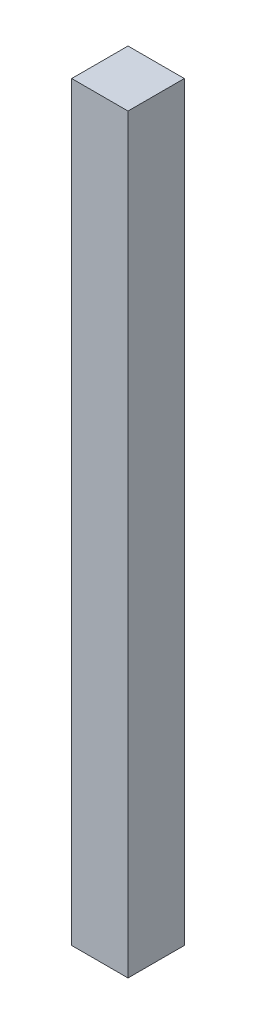
from build123d import *

# Parameters (mm, degrees)
SKETCH1_W           = 15
SKETCH1_H           = 15
BOSS_EXTRUDE1_DEPTH = 100


with BuildPart() as part:
    # Sketch1 → Boss-Extrude1 (new, symmetric)
    with BuildSketch(Plane(origin=(0, 0, 0), x_dir=(1, 0, 0), z_dir=(0, 1, 0))):
        Rectangle(SKETCH1_W, SKETCH1_H)
    extrude(amount=BOSS_EXTRUDE1_DEPTH, both=True)


solid = part.part
